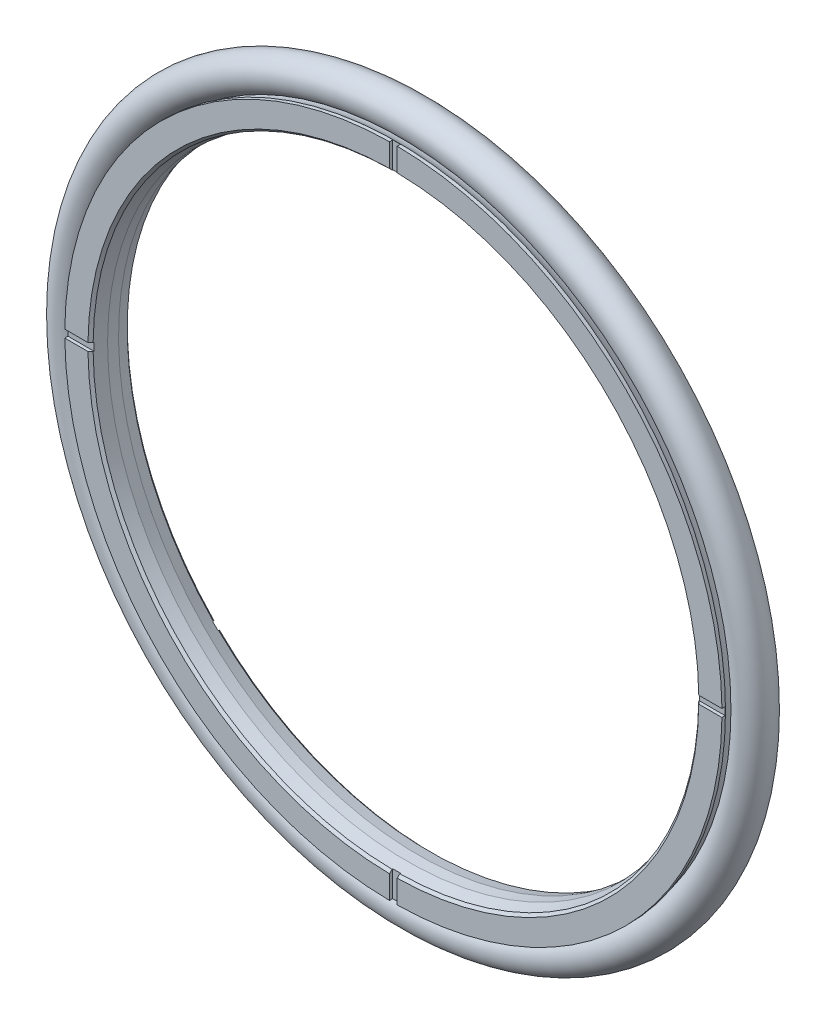
from build123d import *

# Parameters (mm, degrees)
SKETCH3_W          = 1.2
SKETCH3_H          = 54.567734246
CUT_EXTRUDE1_DEPTH = 0.5
CUT_EXTRUDE2_DEPTH = 0.5
CIRPATTERN1_COUNT  = 4
SKETCH2_R          = 2.665


with BuildPart() as part:
    # Sketch1 → Revolve1 (revolve)
    with BuildSketch(Plane(origin=(0, 0, 0), x_dir=(0, 0, -1), z_dir=(1, 0, 0)), mode=Mode.PRIVATE) as revolve1_sk:
        with BuildLine():
            Line((-3.05, 51.05), (-3.05, 47.45))
            Line((-3.05, 47.45), (-2.65, 47.05))
            Line((-2.65, 47.05), (-0.85, 46.6))
            Line((-0.85, 46.6), (0.85, 46.6))
            Line((0.85, 46.6), (2.65, 47.05))
            Line((2.65, 47.05), (3.05, 47.45))
            Line((3.05, 47.45), (3.05, 51.05))
            Line((3.05, 51.05), (2.49949995, 51.05))
            ThreePointArc((2.49949995, 51.05), (0, 50), (-2.49949995, 51.05))
            Line((-2.49949995, 51.05), (-3.05, 51.05))
        make_face()
    revolve(revolve1_sk.sketch.rotate(Axis((0, 0, 0), (0, 0, -1)), 90), axis=Axis((0, 0, 0), (0, 0, -1)))

    # Sketch3 → Cut-Extrude1 (cut)
    with BuildSketch(Plane.XY.offset(3.05)):
        with Locations((0, 27.283867123)):
            Rectangle(SKETCH3_W, SKETCH3_H)
    cut_extrude1 = extrude(amount=-CUT_EXTRUDE1_DEPTH, mode=Mode.SUBTRACT)

    # Sketch4 → Cut-Extrude2 (cut)
    with BuildSketch(Plane(origin=(0, 0, -3.05), x_dir=(-1, 0, 0), z_dir=(0, 0, -1))):
        Polygon((0.424264069, -0.424264069), (-0.424264069, 0.424264069), (46.107028369, 46.955556506), (46.955556506, 46.107028369), align=None)
    cut_extrude2 = extrude(amount=-CUT_EXTRUDE2_DEPTH, mode=Mode.SUBTRACT)

    # CirPattern1: Cut-Extrude1, Cut-Extrude2 ×4 about axis
    cirpattern1_axis = Axis((0, 0, 0), (0, 0, 1))
    add([cut_extrude1.rotate(cirpattern1_axis, i * 360 / CIRPATTERN1_COUNT) for i in range(1, CIRPATTERN1_COUNT)], mode=Mode.SUBTRACT)
    add([cut_extrude2.rotate(cirpattern1_axis, i * 360 / CIRPATTERN1_COUNT) for i in range(1, CIRPATTERN1_COUNT)], mode=Mode.SUBTRACT)


with BuildPart() as body_2:
    # Sketch2 → Revolve2 (revolve)
    with BuildSketch(Plane(origin=(0, 0, 0), x_dir=(0, 0, -1), z_dir=(1, 0, 0)), mode=Mode.PRIVATE) as revolve2_sk:
        with Locations((0, 53.165)):
            Circle(SKETCH2_R)
    revolve(revolve2_sk.sketch.rotate(Axis((0, 0, 0), (0, 0, -1)), 225.731066465), axis=Axis((0, 0, 0), (0, 0, -1)))


solid = Compound([part.part, body_2.part])
